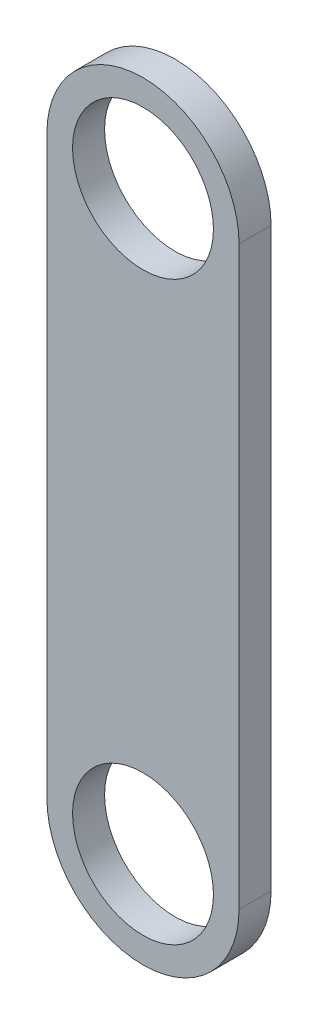
from build123d import *

# Parameters (mm, degrees)
SKETCH_1_R               = 11
EXTRUDE_1_DEPTH          = 72
SKETCH_2_W               = 62
SKETCH_2_H               = 70
SKETCH_2_H_2             = 67.94057246
CUT_EXTRUDE_1_DEPTH      = 70
EXTRUDE_2_DEPTH          = 62
EXTRUDE_3_DEPTH          = 62
CUT_EXTRUDE_4_DEPTH      = 136.359998088
CUT_EXTRUDE_4_DEPTH_BACK = 136.359998088
SKETCH_7_W               = 62
SKETCH_7_H               = 120


with BuildPart() as part:
    # 草图1 → 凸台-拉伸1 (new body)
    with BuildSketch(Plane.XY):
        with BuildLine():
            Line((-15, 90), (-15, 0))
            ThreePointArc((-15, 0), (0, -15), (15, 0))
            Line((15, 0), (15, 90))
            ThreePointArc((15, 90), (0, 105), (-15, 90))
        make_face()
        Circle(SKETCH_1_R, mode=Mode.SUBTRACT)
        with Locations((0, 90)):
            Circle(SKETCH_1_R, mode=Mode.SUBTRACT)
    extrude(amount=EXTRUDE_1_DEPTH)

    # 草图2 → 切除-拉伸1 (cut)
    with BuildSketch(Plane.ZY.offset(15)):
        with Locations((36, 80)):
            Rectangle(SKETCH_2_W, SKETCH_2_H)
        with Locations((36, 11.02971377)):
            Rectangle(SKETCH_2_W, SKETCH_2_H_2)
    extrude(amount=-CUT_EXTRUDE_1_DEPTH, mode=Mode.SUBTRACT)


with BuildPart() as cut_extrude_1_piece_1:
    # of the separate pieces the step leaves, piece 1, a body of its own (cut_extrude_1_pieces)
    add(part.part.solids().sort_by_distance((15, 0, 0))[0])



with BuildPart() as cut_extrude_1_piece_2:
    # of the separate pieces the step leaves, piece 2, a body of its own (cut_extrude_1_pieces)
    add(part.part.solids().sort_by_distance((15, 0, 67))[0])


with BuildPart() as cut_extrude_1_piece_1_1:
    add(cut_extrude_1_piece_1.part)

    add(cut_extrude_1_piece_2.part)  # 凸台-拉伸2 merges 切除-拉伸1 piece 2
    # 草图4 → 凸台-拉伸2 (add)
    with BuildSketch(Plane(origin=(0, 0, 67), x_dir=(-1, 0, 0), z_dir=(0, 0, -1))):
        with BuildLine():
            Line((-4.490156776, 68.758657712), (15, 57.50601045))
            Line((15, 57.50601045), (36.319312502, 12.911360415))
            ThreePointArc((36.319312502, 12.911360415), (35.142094618, 9.577570071), (31.808304274, 10.754787955))
            Line((31.808304274, 10.754787955), (15, 45.913541163))
            Line((15, 45.913541163), (-9.509843224, 60.064305746))
            ThreePointArc((-9.509843224, 60.064305746), (-11.347175983, 66.921324953), (-4.490156776, 68.758657712))
        make_face()
    extrude(amount=EXTRUDE_2_DEPTH)

    # 草图5 → 凸台-拉伸3 (add)
    with BuildSketch(Plane(origin=(0, 0, 67), x_dir=(-1, 0, 0), z_dir=(0, 0, -1))):
        with BuildLine():
            Line((-30.017605928, 49.094069219), (-15, 60.919508718))
            Line((-15, 60.919508718), (12.5, 45.042376315))
            ThreePointArc((12.5, 45.042376315), (14.330127019, 38.212249296), (7.5, 36.382122277))
            Line((7.5, 36.382122277), (-15, 49.372503334))
            Line((-15, 49.372503334), (-27.615908762, 44.780688066))
            ThreePointArc((-27.615908762, 44.780688066), (-30.655195979, 45.913733224), (-30.017605928, 49.094069219))
        make_face()
    extrude(amount=EXTRUDE_3_DEPTH)

    # 草图7 → 切除-拉伸4 (cut, two sides: drawn at the far end of the back side and taken through both)
    with BuildSketch(Plane.ZY.offset(15).offset(-CUT_EXTRUDE_4_DEPTH_BACK)):
        with Locations((36, 45)):
            Rectangle(SKETCH_7_W, SKETCH_7_H)
    extrude(amount=CUT_EXTRUDE_4_DEPTH + CUT_EXTRUDE_4_DEPTH_BACK, mode=Mode.SUBTRACT)


with BuildPart() as cut_extrude_4_piece_1:
    # of the separate pieces the step leaves, piece 1, a body of its own (cut_extrude_4_pieces)
    add(cut_extrude_1_piece_1_1.part.solids().sort_by_distance((-15, 90, 5))[0])


with BuildPart() as cut_extrude_4_piece_2:
    # of the separate pieces the step leaves, piece 2, a body of its own (cut_extrude_4_pieces)
    add(cut_extrude_1_piece_1_1.part.solids().sort_by_distance((15, 0, 67))[0])


solid = cut_extrude_4_piece_2.part
